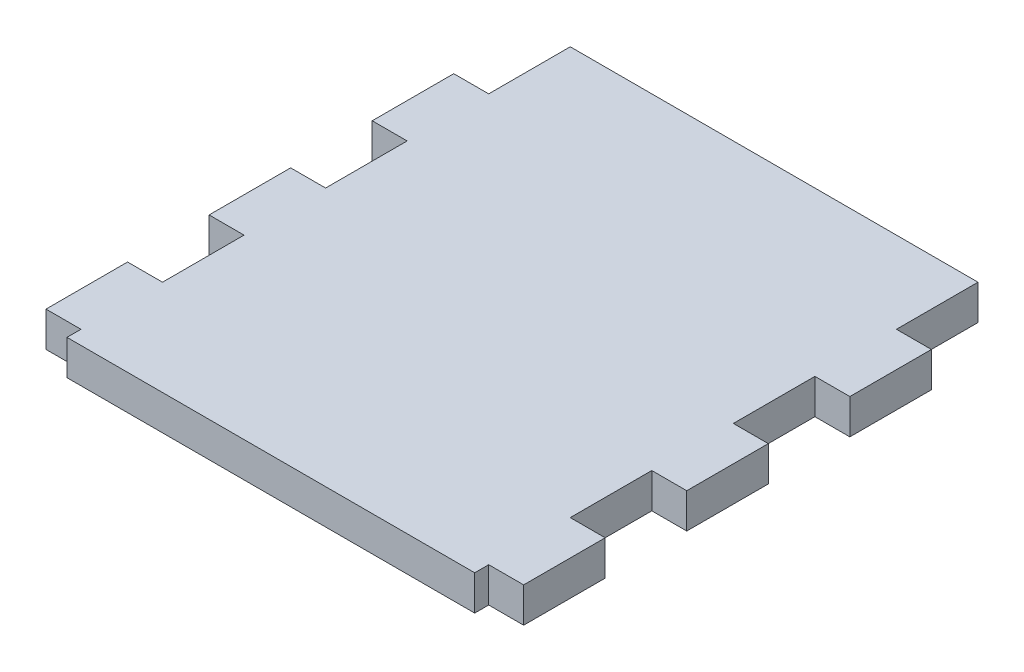
from build123d import *

# Parameters (mm, degrees)
SKETCH1_W           = 3
SKETCH1_H           = 7
SKETCH1_W_2         = 35
SKETCH1_H_2         = 1.2
BOSS_EXTRUDE1_DEPTH = 3


with BuildPart() as part:
    # Sketch1 → Boss-Extrude1 (new body)
    with BuildSketch(Plane(origin=(0, 0, 0), x_dir=(1, 0, 0), z_dir=(0, 1, 0))):
        Polygon((35, 42), (17.5, 42), (17.5, 0), (35, 0), (35, 7), (35, 14), (35, 21), (35, 28), (35, 35), align=None)
        with Locations((36.5, 31.5)):
            Rectangle(SKETCH1_W, SKETCH1_H)
        with Locations((36.5, 17.5)):
            Rectangle(SKETCH1_W, SKETCH1_H)
        with Locations((36.5, 3.5)):
            Rectangle(SKETCH1_W, SKETCH1_H)
        Polygon((17.5, 0), (17.5, 42), (0, 42), (0, 35), (0, 28), (0, 21), (0, 14), (0, 7), (0, 0), align=None)
        with Locations((17.5, -0.6)):
            Rectangle(SKETCH1_W_2, SKETCH1_H_2)
        with Locations((-1.5, 3.5)):
            Rectangle(SKETCH1_W, SKETCH1_H)
        with Locations((-1.5, 17.5)):
            Rectangle(SKETCH1_W, SKETCH1_H)
        with Locations((-1.5, 31.5)):
            Rectangle(SKETCH1_W, SKETCH1_H)
    extrude(amount=BOSS_EXTRUDE1_DEPTH)


solid = part.part
